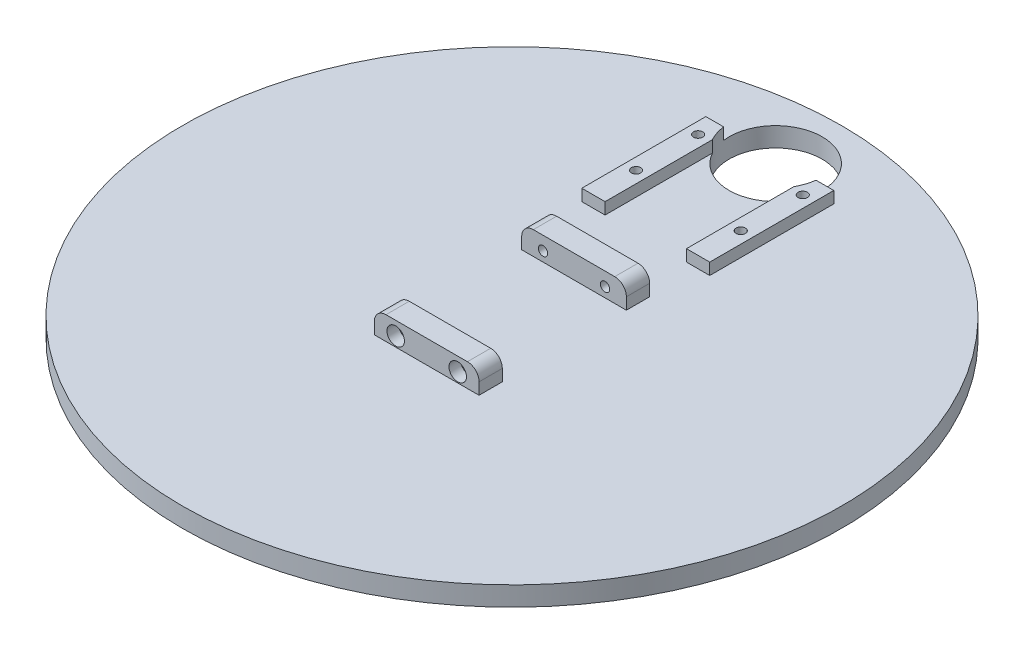
from build123d import *

# Parameters (mm, degrees)
SKETCH1_R                                           = 37.65
SKETCH1_R_2                                         = 32.65
BOSS_EXTRUDE1_DEPTH                                 = 10
BOSS_EXTRUDE2_START                                 = -4
SKETCH2_R                                           = 32.65
SKETCH2_R_2                                         = 29.65
BOSS_EXTRUDE2_DEPTH                                 = 4
SKETCH3_R                                           = 85
BOSS_EXTRUDE3_DEPTH                                 = 5
SKETCH4_W                                           = 27
SKETCH4_H                                           = 6
BOSS_EXTRUDE4_DEPTH                                 = 6
FILLET1_R                                           = 3
SKETCH6_R                                           = 2.25
CUT_EXTRUDE1_DEPTH                                  = 3
CSK_FOR_M2_COUNTERSUNK_FLAT_HEAD_SCREW1_D           = 2.4
CSK_FOR_M2_COUNTERSUNK_FLAT_HEAD_SCREW1_CSINK_D     = 4.4
CSK_FOR_M2_COUNTERSUNK_FLAT_HEAD_SCREW1_CSINK_ANGLE = 90
FILLET1_OF_MIRROR1_R                                = 3
SKETCH8_R                                           = 2.25
CUT_EXTRUDE2_DEPTH                                  = 5
SKETCH11_W                                          = 6
SKETCH11_H                                          = 16
BOSS_EXTRUDE5_DEPTH                                 = 3
CSK_FOR_M2_COUNTERSUNK_FLAT_HEAD_SCREW2_D           = 2.4
CSK_FOR_M2_COUNTERSUNK_FLAT_HEAD_SCREW2_CSINK_D     = 4.4
CSK_FOR_M2_COUNTERSUNK_FLAT_HEAD_SCREW2_CSINK_ANGLE = 90
LPATTERN1_COUNT                                     = 2
LPATTERN1_PITCH                                     = 16
LPATTERN1_COPY_1_SKETCH_R                           = 2.25
LPATTERN1_COPY_1_DEPTH                              = 5
LPATTERN1_COPY_2_SKETCH_W                           = 6
LPATTERN1_COPY_2_SKETCH_H                           = 16
LPATTERN1_COPY_2_DEPTH                              = 3
LPATTERN1_COPY_3_D                                  = 2.4
LPATTERN1_COPY_3_CSINK_D                            = 4.4
LPATTERN1_COPY_3_CSINK_ANGLE                        = 90
CUT_EXTRUDE3_DEPTH                                  = 122.140414396
CUT_EXTRUDE3_DEPTH_BACK                             = 122.140414396
SKETCH12_R                                          = 12


with BuildPart() as part:
    # Sketch1 → Boss-Extrude1 (new body)
    with BuildSketch(Plane(origin=(0, 0, 0), x_dir=(1, 0, 0), z_dir=(0, 1, 0))):
        with Locations(Location((0, 0, 0), (0, 0, 270))):
            Circle(SKETCH1_R)
        with Locations(Location((0, 0, 0), (0, 0, 270))):
            Circle(SKETCH1_R_2, mode=Mode.SUBTRACT)
    extrude(amount=BOSS_EXTRUDE1_DEPTH)

    # Sketch2 → Boss-Extrude2 (add)
    with BuildSketch(Plane(origin=(0, 10, 0), x_dir=(1, 0, 0), z_dir=(0, 1, 0)).offset(BOSS_EXTRUDE2_START)):
        with Locations(Location((0, 0, 0), (0, 0, 270))):
            Circle(SKETCH2_R)
        with Locations(Location((0, 0, 0), (0, 0, 270))):
            Circle(SKETCH2_R_2, mode=Mode.SUBTRACT)
    extrude(amount=BOSS_EXTRUDE2_DEPTH)

    # Sketch3 → Boss-Extrude3 (add)
    with BuildSketch(Plane(origin=(0, 10, 0), x_dir=(1, 0, 0), z_dir=(0, 1, 0))):
        with Locations(Location((0, 0, 0), (0, 0, 270))):
            Circle(SKETCH3_R)
    extrude(amount=BOSS_EXTRUDE3_DEPTH)

    # Sketch4 → Boss-Extrude4 (add)
    with BuildSketch(Plane(origin=(0, 15, 0), x_dir=(1, 0, 0), z_dir=(0, 1, 0))):
        with Locations((0, 19)):
            Rectangle(SKETCH4_W, SKETCH4_H)
    boss_extrude4 = extrude(amount=BOSS_EXTRUDE4_DEPTH)

    # Fillet1
    fillet1_edges = [part.edges().sort_by_distance(p)[0] for p in [
        (-13.5, 21, -19),
        (13.5, 21, -19),
    ]]
    fillet(fillet1_edges, radius=FILLET1_R)

    # Sketch6 → Cut-Extrude1 (cut)
    with BuildSketch(Plane(origin=(0, 0, -22), x_dir=(-1, 0, 0), z_dir=(0, 0, -1))):
        with Locations((-8, 17.5)):
            Circle(SKETCH6_R)
        with Locations((8, 17.5)):
            Circle(SKETCH6_R)
    cut_extrude1 = extrude(amount=-CUT_EXTRUDE1_DEPTH, mode=Mode.SUBTRACT)

    # CSK for M2 Countersunk Flat Head Screw1 (through all)
    with Locations(Plane(origin=(8, 17.5, -19), x_dir=(-1, 0, 0), z_dir=(0, 0, -1))):
        with Locations((0, 0), (16, 0)):
            csk_for_m2_countersunk_flat_head_screw1 = CounterSinkHole(CSK_FOR_M2_COUNTERSUNK_FLAT_HEAD_SCREW1_D / 2, CSK_FOR_M2_COUNTERSUNK_FLAT_HEAD_SCREW1_CSINK_D / 2, counter_sink_angle=CSK_FOR_M2_COUNTERSUNK_FLAT_HEAD_SCREW1_CSINK_ANGLE)

    # Mirror1: Boss-Extrude4, Cut-Extrude1, CSK for M2 Countersunk Flat Head Screw1 across plane
    add(boss_extrude4.mirror(Plane.XY))
    add(cut_extrude1.mirror(Plane.XY), mode=Mode.SUBTRACT)
    add(csk_for_m2_countersunk_flat_head_screw1.mirror(Plane.XY), mode=Mode.SUBTRACT)

    # Fillet1 of Mirror1
    fillet1_of_mirror1_edges = [part.edges().sort_by_distance(p)[0] for p in [
        (-13.5, 21, 19),
        (13.5, 21, 19),
    ]]
    fillet(fillet1_of_mirror1_edges, radius=FILLET1_OF_MIRROR1_R)

    # Sketch8 → Cut-Extrude2 (cut)
    with BuildSketch(Plane(origin=(0, 10, 0), x_dir=(-1, 0, 0), z_dir=(0, -1, 0))):
        with Locations(Location((13.5, 61.5, 0), (0, 0, 90))):
            Circle(SKETCH8_R)
    cut_extrude2 = extrude(amount=-CUT_EXTRUDE2_DEPTH, mode=Mode.SUBTRACT)

    # Sketch11 → Boss-Extrude5 (add)
    with BuildSketch(Plane(origin=(0, 15, 0), x_dir=(1, 0, 0), z_dir=(0, 1, 0))):
        with Locations((-13.5, 58.5)):
            Rectangle(SKETCH11_W, SKETCH11_H)
    boss_extrude5 = extrude(amount=BOSS_EXTRUDE5_DEPTH)

    # CSK for M2 Countersunk Flat Head Screw2 (through all)
    with Locations(Plane(origin=(-13.5, 15, -61.5), x_dir=(0, 0, -1), z_dir=(0, -1, 0))):
        with Locations((0, 0)):
            csk_for_m2_countersunk_flat_head_screw2 = CounterSinkHole(CSK_FOR_M2_COUNTERSUNK_FLAT_HEAD_SCREW2_D / 2, CSK_FOR_M2_COUNTERSUNK_FLAT_HEAD_SCREW2_CSINK_D / 2, counter_sink_angle=CSK_FOR_M2_COUNTERSUNK_FLAT_HEAD_SCREW2_CSINK_ANGLE)

    # Mirror2: Cut-Extrude2, Boss-Extrude5, CSK for M2 Countersunk Flat Head Screw2 across plane
    add(cut_extrude2.mirror(Plane(origin=(0, 0, 0), x_dir=(0, 0, 1), z_dir=(1, 0, 0))), mode=Mode.SUBTRACT)
    add(boss_extrude5.mirror(Plane(origin=(0, 0, 0), x_dir=(0, 0, 1), z_dir=(1, 0, 0))))
    add(csk_for_m2_countersunk_flat_head_screw2.mirror(Plane(origin=(0, 0, 0), x_dir=(0, 0, 1), z_dir=(1, 0, 0))), mode=Mode.SUBTRACT)

    # LPattern1: Cut-Extrude2, Boss-Extrude5, CSK for M2 Countersunk Flat Head Screw2 ×2
    with Locations(*[(0, 0, i * LPATTERN1_PITCH) for i in range(1, LPATTERN1_COUNT)]):
        add(cut_extrude2, mode=Mode.SUBTRACT)
        add(boss_extrude5)
        add(csk_for_m2_countersunk_flat_head_screw2, mode=Mode.SUBTRACT)

    # LPattern1 copy 1 sketch → LPattern1 copy 1 (cut)
    with BuildSketch(Plane(origin=(0, 10, 16), x_dir=(1, 0, 0), z_dir=(0, -1, 0))):
        with Locations((13.5, -61.5)):
            Circle(LPATTERN1_COPY_1_SKETCH_R)
    extrude(amount=-LPATTERN1_COPY_1_DEPTH, mode=Mode.SUBTRACT)

    # LPattern1 copy 2 sketch → LPattern1 copy 2 (add)
    with BuildSketch(Plane(origin=(0, 15, 16), x_dir=(-1, 0, 0), z_dir=(0, 1, 0))):
        with Locations((-13.5, -58.5)):
            Rectangle(LPATTERN1_COPY_2_SKETCH_W, LPATTERN1_COPY_2_SKETCH_H)
    extrude(amount=LPATTERN1_COPY_2_DEPTH)

    # LPattern1 copy 3 (through all)
    with Locations(Plane(origin=(13.5, 15, -45.5), x_dir=(0, 0, -1), z_dir=(0, -1, 0))):
        with Locations((0, 0)):
            CounterSinkHole(LPATTERN1_COPY_3_D / 2, LPATTERN1_COPY_3_CSINK_D / 2, counter_sink_angle=LPATTERN1_COPY_3_CSINK_ANGLE)

    # Sketch12 → Cut-Extrude3 (cut, two sides: drawn at the far end of the back side and taken through both)
    with BuildSketch(Plane(origin=(0, 15, 0), x_dir=(1, 0, 0), z_dir=(0, 1, 0)).offset(-CUT_EXTRUDE3_DEPTH_BACK)):
        with Locations(Location((0, 68, 0), (0, 0, 270))):
            Circle(SKETCH12_R)
    extrude(amount=CUT_EXTRUDE3_DEPTH + CUT_EXTRUDE3_DEPTH_BACK, mode=Mode.SUBTRACT)


solid = part.part
